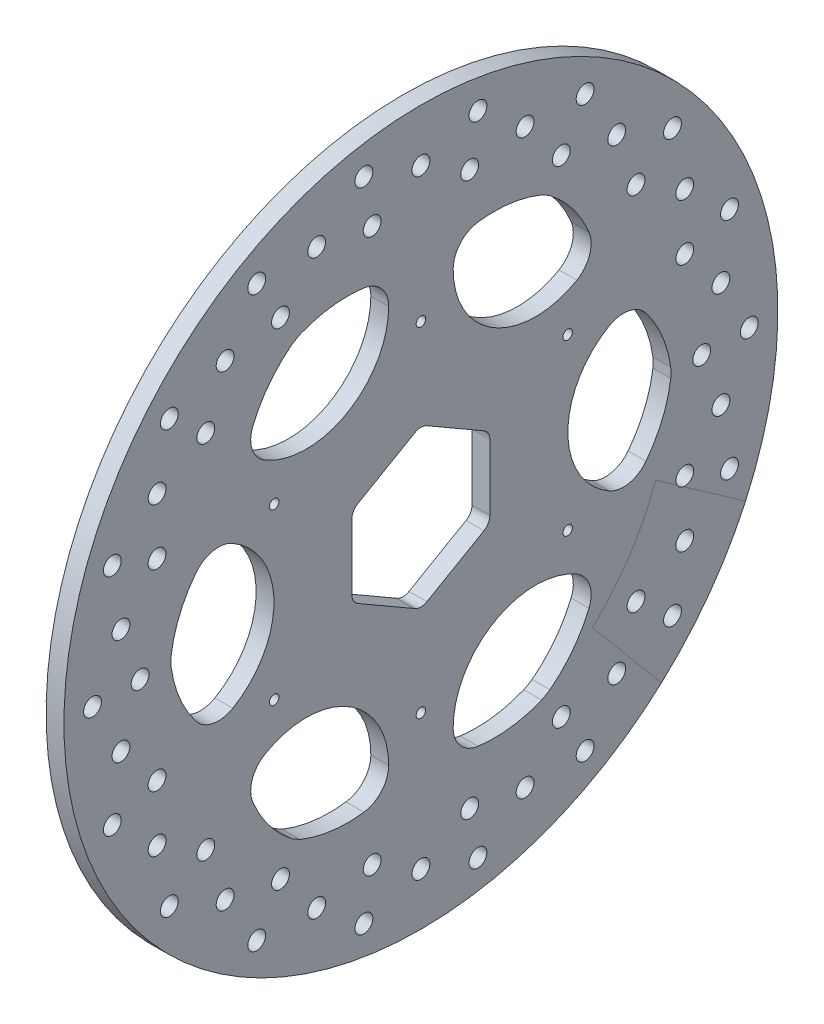
from build123d import *

# Parameters (mm, degrees)
SKETCH1_R           = 95.25
SKETCH1_R_2         = 66.675
MAIN_ROTOR_DEPTH    = 4.7625
SKETCH2_R           = 2.38125
CUT_SLOTS_DEPTH     = 135.788005424
BOSS_EXTRUDE2_START = -4.7625
BOSS_EXTRUDE2_DEPTH = 4.7625
FILLET1_R           = 3.175
SKETCH4_R           = 1.27
CUT_EXTRUDE2_DEPTH  = 135.788005424


with BuildPart() as part:
    # Sketch1 → Main Rotor (new body)
    with BuildSketch(Plane(origin=(0, 0, 0), x_dir=(0, 0, -1), z_dir=(1, 0, 0))):
        with Locations(Location((0, 0, 0), (0, 0, 180))):
            Circle(SKETCH1_R)
        with Locations(Location((0, 0, 0), (0, 0, 180))):
            Circle(SKETCH1_R_2, mode=Mode.SUBTRACT)
    extrude(amount=MAIN_ROTOR_DEPTH)

    # Sketch2 → Cut Slots (cut, through all)
    with BuildSketch(Plane(origin=(4.7625, 0, 0), x_dir=(0, 0, -1), z_dir=(1, 0, 0))):
        with Locations((-80.045174165, 14.114123881)):
            Circle(SKETCH2_R)
        with Locations((-82.345264359, 29.97122516)):
            Circle(SKETCH2_R)
        with Locations((-70.411168075, 25.627569339)):
            Circle(SKETCH2_R)
        with Locations((-70.39054482, 40.64)):
            Circle(SKETCH2_R)
        with Locations((-67.128474551, 56.327478237)):
            Circle(SKETCH2_R)
        with Locations((-57.399710123, 48.164075594)):
            Circle(SKETCH2_R)
        with Locations((-52.245776915, 62.264092337)):
            Circle(SKETCH2_R)
        with Locations((-87.63, 0)):
            Circle(SKETCH2_R)
        with Locations((-43.815, 75.889806134)):
            Circle(SKETCH2_R)
        with Locations((-37.465, 64.891283506)):
            Circle(SKETCH2_R)
        with Locations((-74.93, 0)):
            Circle(SKETCH2_R)
        with Locations((-27.79939725, 76.378216217)):
            Circle(SKETCH2_R)
        with Locations((-15.216789809, 86.298703396)):
            Circle(SKETCH2_R)
        with Locations((-13.011457953, 73.791644933)):
            Circle(SKETCH2_R)
        with Locations((0, 81.28)):
            Circle(SKETCH2_R)
        with Locations((15.216789809, 86.298703396)):
            Circle(SKETCH2_R)
        with Locations((13.011457953, 73.791644933)):
            Circle(SKETCH2_R)
        with Locations((27.79939725, 76.378216217)):
            Circle(SKETCH2_R)
        with Locations((43.815, 75.889806134)):
            Circle(SKETCH2_R)
        with Locations((37.465, 64.891283506)):
            Circle(SKETCH2_R)
        with Locations((52.245776915, 62.264092337)):
            Circle(SKETCH2_R)
        with Locations((67.128474551, 56.327478237)):
            Circle(SKETCH2_R)
        with Locations((57.399710123, 48.164075594)):
            Circle(SKETCH2_R)
        with Locations((70.39054482, 40.64)):
            Circle(SKETCH2_R)
        with Locations((82.345264359, 29.97122516)):
            Circle(SKETCH2_R)
        with Locations((70.411168075, 25.627569339)):
            Circle(SKETCH2_R)
        with Locations((80.045174165, 14.114123881)):
            Circle(SKETCH2_R)
        with Locations((87.63, 0)):
            Circle(SKETCH2_R)
        with Locations((74.93, 0)):
            Circle(SKETCH2_R)
        with Locations((80.045174165, -14.114123881)):
            Circle(SKETCH2_R)
        with Locations((82.345264359, -29.97122516)):
            Circle(SKETCH2_R)
        with Locations((70.411168075, -25.627569339)):
            Circle(SKETCH2_R)
        with Locations((70.39054482, -40.64)):
            Circle(SKETCH2_R)
        with Locations((67.128474551, -56.327478237)):
            Circle(SKETCH2_R)
        with Locations((57.399710123, -48.164075594)):
            Circle(SKETCH2_R)
        with Locations((52.245776915, -62.264092337)):
            Circle(SKETCH2_R)
        with Locations((43.815, -75.889806134)):
            Circle(SKETCH2_R)
        with Locations((37.465, -64.891283506)):
            Circle(SKETCH2_R)
        with Locations((27.79939725, -76.378216217)):
            Circle(SKETCH2_R)
        with Locations((15.216789809, -86.298703396)):
            Circle(SKETCH2_R)
        with Locations((13.011457953, -73.791644933)):
            Circle(SKETCH2_R)
        with Locations((0, -81.28)):
            Circle(SKETCH2_R)
        with Locations((-15.216789809, -86.298703396)):
            Circle(SKETCH2_R)
        with Locations((-13.011457953, -73.791644933)):
            Circle(SKETCH2_R)
        with Locations((-27.79939725, -76.378216217)):
            Circle(SKETCH2_R)
        with Locations((-43.815, -75.889806134)):
            Circle(SKETCH2_R)
        with Locations((-37.465, -64.891283506)):
            Circle(SKETCH2_R)
        with Locations((-52.245776915, -62.264092337)):
            Circle(SKETCH2_R)
        with Locations((-67.128474551, -56.327478237)):
            Circle(SKETCH2_R)
        with Locations((-57.399710123, -48.164075594)):
            Circle(SKETCH2_R)
        with Locations((-70.39054482, -40.64)):
            Circle(SKETCH2_R)
        with Locations((-82.345264359, -29.97122516)):
            Circle(SKETCH2_R)
        with Locations((-70.411168075, -25.627569339)):
            Circle(SKETCH2_R)
        with Locations((-80.045174165, -14.114123881)):
            Circle(SKETCH2_R)
    extrude(amount=-CUT_SLOTS_DEPTH, mode=Mode.SUBTRACT)

    # Sketch3 → Boss-Extrude2 (add)
    with BuildSketch(Plane(origin=(4.7625, 0, 0), x_dir=(0, 0, -1), z_dir=(1, 0, 0)).offset(BOSS_EXTRUDE2_START)):
        with BuildLine():
            ThreePointArc((8.604258147, -53.0208121), (10.49630902, -58.039692226), (15.226370254, -60.56863172))
            ThreePointArc((15.226370254, -60.56863172), (23.872972888, -60.579734486), (32.23159957, -58.366768064))
            ThreePointArc((32.23159957, -58.366768064), (0, -66.675), (-32.23159957, -58.366768064))
            ThreePointArc((-32.23159957, -58.366768064), (-23.872972888, -60.579734486), (-15.226370254, -60.56863172))
            ThreePointArc((-15.226370254, -60.56863172), (-10.49630902, -58.039692226), (-8.604258147, -53.0208121))
            ThreePointArc((-8.604258147, -53.0208121), (-11.546477683, -42.011879168), (-19.60245, -33.952439353))
            ThreePointArc((-19.60245, -33.952439353), (-30.610115778, -31.005482581), (-41.615241134, -33.961912186))
            ThreePointArc((-41.615241134, -33.961912186), (-45.015693386, -38.109916371), (-44.840788615, -43.470739307))
            ThreePointArc((-44.840788615, -43.470739307), (-40.527102575, -50.964468228), (-34.431304095, -57.096768064))
            ThreePointArc((-34.431304095, -57.096768064), (-57.742243797, -33.3375), (-66.662903665, -1.27))
            ThreePointArc((-66.662903665, -1.27), (-64.400075463, -9.615266258), (-60.067158869, -17.097892412))
            ThreePointArc((-60.067158869, -17.097892412), (-55.512002406, -19.929775856), (-50.219499281, -19.058899914))
            ThreePointArc((-50.219499281, -19.058899914), (-42.156593461, -11.006396586), (-39.2049, 0))
            ThreePointArc((-39.2049, 0), (-42.156593461, 11.006396586), (-50.219499281, 19.058899914))
            ThreePointArc((-50.219499281, 19.058899914), (-55.512002406, 19.929775856), (-60.067158869, 17.097892412))
            ThreePointArc((-60.067158869, 17.097892412), (-64.400075463, 9.615266258), (-66.662903665, 1.27))
            ThreePointArc((-66.662903665, 1.27), (-57.742243797, 33.3375), (-34.431304095, 57.096768064))
            ThreePointArc((-34.431304095, 57.096768064), (-40.527102575, 50.964468228), (-44.840788615, 43.470739307))
            ThreePointArc((-44.840788615, 43.470739307), (-45.015693386, 38.109916371), (-41.615241134, 33.961912186))
            ThreePointArc((-41.615241134, 33.961912186), (-30.610115778, 31.005482581), (-19.60245, 33.952439353))
            ThreePointArc((-19.60245, 33.952439353), (-11.546477683, 42.011879168), (-8.604258147, 53.0208121))
            ThreePointArc((-8.604258147, 53.0208121), (-10.49630902, 58.039692226), (-15.226370254, 60.56863172))
            ThreePointArc((-15.226370254, 60.56863172), (-23.872972888, 60.579734486), (-32.23159957, 58.366768064))
            ThreePointArc((-32.23159957, 58.366768064), (0, 66.675), (32.23159957, 58.366768064))
            ThreePointArc((32.23159957, 58.366768064), (23.872972888, 60.579734486), (15.226370254, 60.56863172))
            ThreePointArc((15.226370254, 60.56863172), (10.49630902, 58.039692226), (8.604258147, 53.0208121))
            ThreePointArc((8.604258147, 53.0208121), (11.546477683, 42.011879168), (19.60245, 33.952439353))
            ThreePointArc((19.60245, 33.952439353), (30.610115778, 31.005482581), (41.615241134, 33.961912186))
            ThreePointArc((41.615241134, 33.961912186), (45.015693386, 38.109916371), (44.840788615, 43.470739307))
            ThreePointArc((44.840788615, 43.470739307), (40.527102575, 50.964468228), (34.431304095, 57.096768064))
            ThreePointArc((34.431304095, 57.096768064), (57.742243797, 33.3375), (66.662903665, 1.27))
            ThreePointArc((66.662903665, 1.27), (64.400075463, 9.615266258), (60.067158869, 17.097892412))
            ThreePointArc((60.067158869, 17.097892412), (55.512002406, 19.929775856), (50.219499281, 19.058899914))
            ThreePointArc((50.219499281, 19.058899914), (42.156593461, 11.006396586), (39.2049, 0))
            ThreePointArc((39.2049, 0), (42.156593461, -11.006396586), (50.219499281, -19.058899914))
            ThreePointArc((50.219499281, -19.058899914), (55.512002406, -19.929775856), (60.067158869, -17.097892412))
            ThreePointArc((60.067158869, -17.097892412), (64.400075463, -9.615266258), (66.662903665, -1.27))
            ThreePointArc((66.662903665, -1.27), (57.742243797, -33.3375), (34.431304095, -57.096768064))
            ThreePointArc((34.431304095, -57.096768064), (40.527102575, -50.964468228), (44.840788615, -43.470739307))
            ThreePointArc((44.840788615, -43.470739307), (45.015693386, -38.109916371), (41.615241134, -33.961912186))
            ThreePointArc((41.615241134, -33.961912186), (30.610115778, -31.005482581), (19.60245, -33.952439353))
            ThreePointArc((19.60245, -33.952439353), (11.546477683, -42.011879168), (8.604258147, -53.0208121))
        make_face()
        Polygon((0, 21.249145717), (-18.4023, 10.624572859), (-18.4023, -10.624572859), (0, -21.249145717), (18.4023, -10.624572859), (18.4023, 10.624572859), align=None, mode=Mode.SUBTRACT)
    extrude(amount=BOSS_EXTRUDE2_DEPTH)

    # Fillet1
    fillet1_edges = [part.edges().sort_by_distance(p)[0] for p in [
        (2.38125, 21.249145717, 0),
        (2.38125, 10.624572859, 18.4023),
        (2.38125, -10.624572859, 18.4023),
        (2.38125, -21.249145717, 0),
        (2.38125, -10.624572859, -18.4023),
        (2.38125, 10.624572859, -18.4023),
    ]]
    fillet(fillet1_edges, radius=FILLET1_R)

    # Sketch4 → Cut-Extrude2 (cut, through all)
    with BuildSketch(Plane.ZY):
        with Locations((0, 45.212)):
            Circle(SKETCH4_R)
        with Locations((39.154740556, 22.606)):
            Circle(SKETCH4_R)
        with Locations((39.154740556, -22.606)):
            Circle(SKETCH4_R)
        with Locations((0, -45.212)):
            Circle(SKETCH4_R)
        with Locations((-39.154740556, -22.606)):
            Circle(SKETCH4_R)
        with Locations((-39.154740556, 22.606)):
            Circle(SKETCH4_R)
    extrude(amount=-CUT_EXTRUDE2_DEPTH, mode=Mode.SUBTRACT)


solid = part.part
